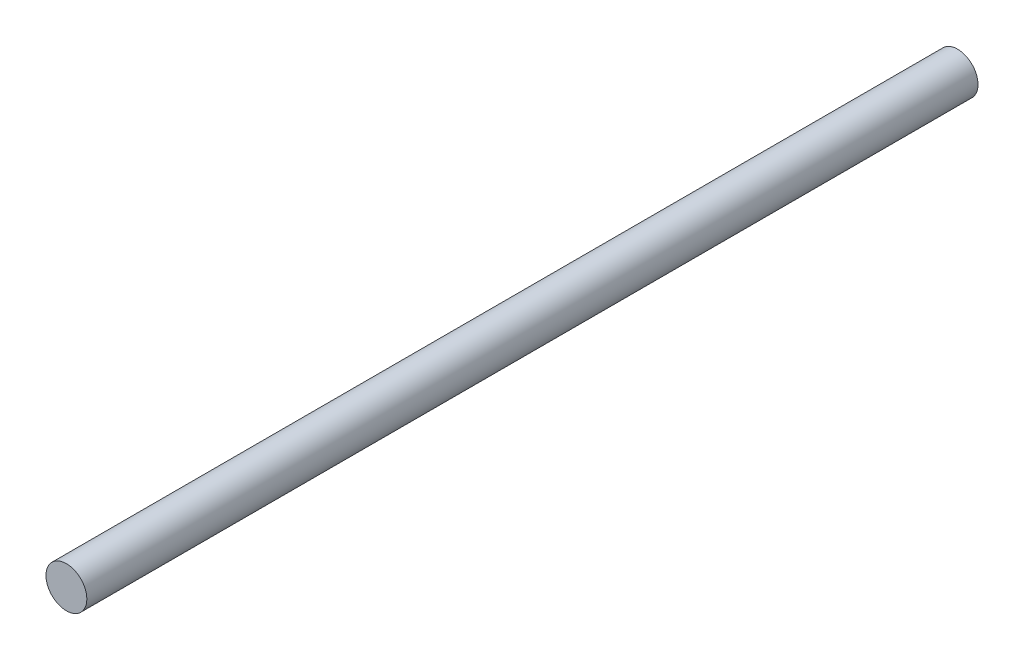
from build123d import *

# Parameters (mm, degrees)
SKETCH1_R           = 5
BOSS_EXTRUDE1_DEPTH = 218


with BuildPart() as part:
    # Sketch1 → Boss-Extrude1 (new body)
    with BuildSketch(Plane.XY):
        Circle(SKETCH1_R)
    extrude(amount=BOSS_EXTRUDE1_DEPTH)


solid = part.part
